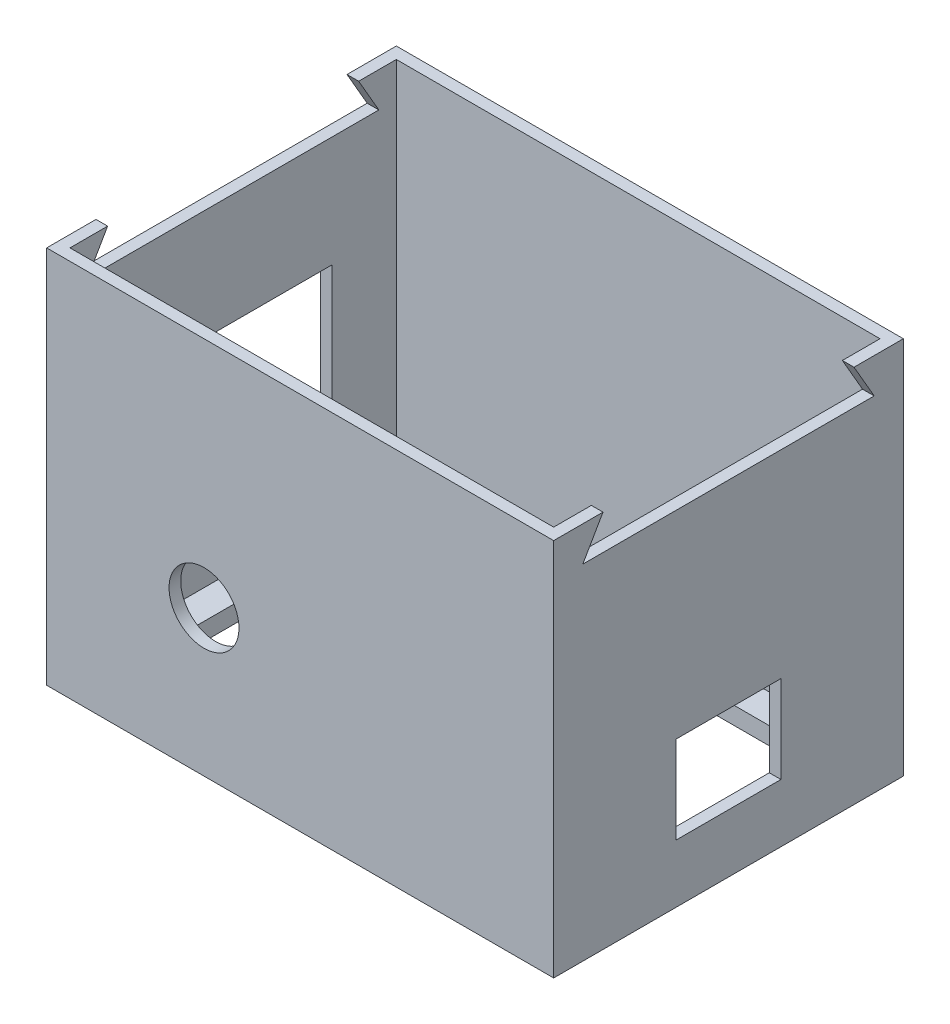
from build123d import *

# Parameters (mm, degrees)
SKETCH1_W           = 87
SKETCH1_H           = 60
BOSS_EXTRUDE1_DEPTH = 65
SKETCH2_W           = 83
SKETCH2_H           = 56
CUT_EXTRUDE1_DEPTH  = 62
SKETCH3_W           = 18
SKETCH3_H           = 15
CUT_EXTRUDE2_DEPTH  = 57
SKETCH4_R           = 6
CUT_EXTRUDE3_DEPTH  = 24
SKETCH5_W           = 34
SKETCH5_H           = 30
CUT_EXTRUDE4_DEPTH  = 24
CUT_EXTRUDE5_DEPTH  = 117
SKETCH7_W           = 73
SKETCH7_H           = 46
CUT_EXTRUDE6_DEPTH  = 10


with BuildPart() as part:
    # Sketch1 → Boss-Extrude1 (new body)
    with BuildSketch(Plane(origin=(0, 0, 0), x_dir=(1, 0, 0), z_dir=(0, 1, 0))):
        with Locations((-43.5, 30)):
            Rectangle(SKETCH1_W, SKETCH1_H)
    extrude(amount=BOSS_EXTRUDE1_DEPTH)

    # Sketch2 → Cut-Extrude1 (cut)
    with BuildSketch(Plane(origin=(0, 65, 0), x_dir=(1, 0, 0), z_dir=(0, 1, 0))):
        with Locations((-43.5, 30)):
            Rectangle(SKETCH2_W, SKETCH2_H)
    extrude(amount=-CUT_EXTRUDE1_DEPTH, mode=Mode.SUBTRACT)

    # Sketch3 → Cut-Extrude2 (cut)
    with BuildSketch(Plane(origin=(0, 0, 0), x_dir=(0, 0, -1), z_dir=(1, 0, 0))):
        with Locations((30, 17.5)):
            Rectangle(SKETCH3_W, SKETCH3_H)
    extrude(amount=-CUT_EXTRUDE2_DEPTH, mode=Mode.SUBTRACT)

    # Sketch4 → Cut-Extrude3 (cut)
    with BuildSketch(Plane.XY):
        with Locations((-60, 25)):
            Circle(SKETCH4_R)
    extrude(amount=-CUT_EXTRUDE3_DEPTH, mode=Mode.SUBTRACT)

    # Sketch5 → Cut-Extrude4 (cut)
    with BuildSketch(Plane.ZY.offset(87)):
        with Locations((-30, 25)):
            Rectangle(SKETCH5_W, SKETCH5_H)
    extrude(amount=-CUT_EXTRUDE4_DEPTH, mode=Mode.SUBTRACT)

    # Sketch6 → Cut-Extrude5 (cut)
    with BuildSketch(Plane(origin=(0, 0, 0), x_dir=(0, 0, -1), z_dir=(1, 0, 0))):
        Polygon((8.464101615, 65), (5, 59), (55, 59), (51.535898385, 65), align=None)
    extrude(amount=-CUT_EXTRUDE5_DEPTH, mode=Mode.SUBTRACT)

    # Sketch7 → Cut-Extrude6 (cut)
    with BuildSketch(Plane(origin=(0, 3, 0), x_dir=(1, 0, 0), z_dir=(0, 1, 0))):
        with Locations((-43.5, 30)):
            Rectangle(SKETCH7_W, SKETCH7_H)
    extrude(amount=-CUT_EXTRUDE6_DEPTH, mode=Mode.SUBTRACT)


solid = part.part
